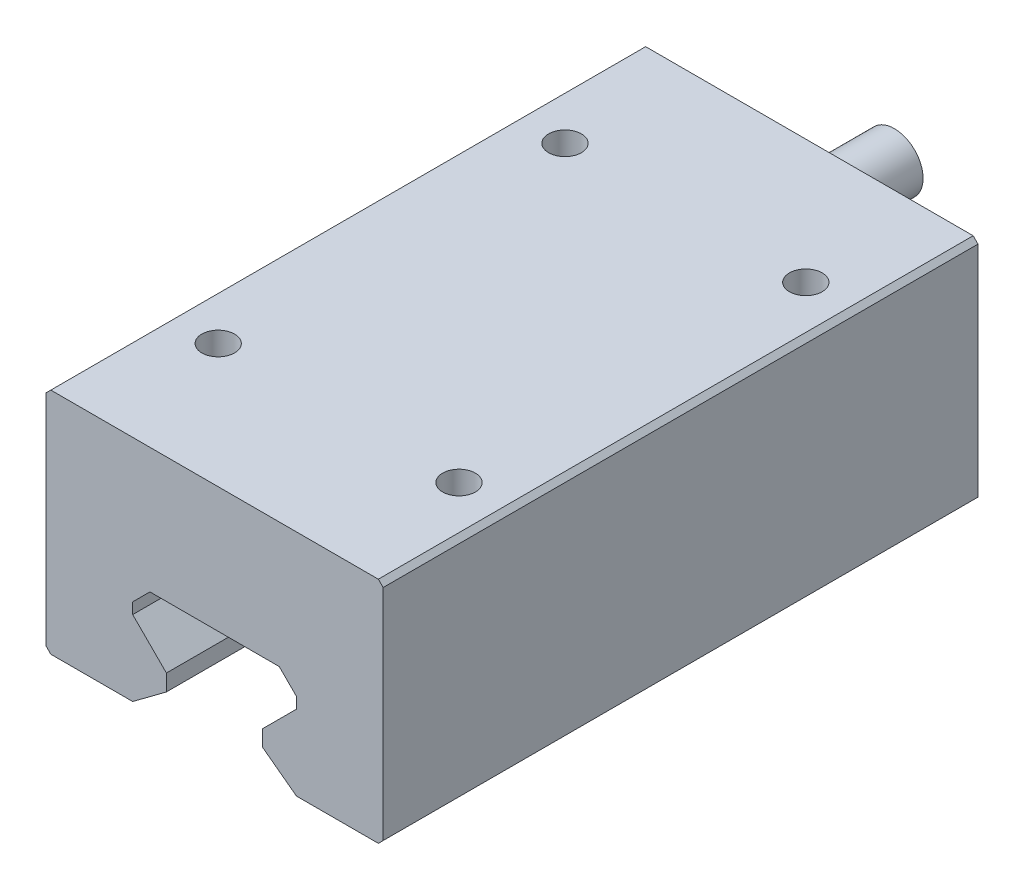
from build123d import *

# Parameters (mm, degrees)
EXTRUDE_1_DEPTH        = 123.5
CHAMFER_1_SIZE         = 1
HOLE_WIZARD_M8_1_D     = 6.8
HOLE_WIZARD_M8_1_DEPTH = 15
HOLE_WIZARD_M8_1_TIP   = 2.042926105
SKETCH_5_R             = 5.961453201
EXTRUDE_2_DEPTH        = 15.6


with BuildPart() as part:
    # 草圖2 → 伸長1 (new body)
    with BuildSketch(Plane.XY):
        Polygon((-17, 7.5), (-35, 7.5), (-35, 55), (35, 55), (35, 7.5), (17, 7.5), (10, 12.721375014), (10, 16.129907798), (17, 23.129907798), (17, 25.4259063), (13.4259063, 29), (-13.4259063, 29), (-17, 25.4259063), (-17, 23.129907798), (-10, 16.129907798), (-10, 12.721375014), align=None)
    extrude(amount=EXTRUDE_1_DEPTH)

    # 導角1
    chamfer_1_edges = [part.edges().sort_by_distance(p)[0] for p in [
        (-35, 7.5, 61.75),
        (-35, 55, 61.75),
        (35, 55, 61.75),
        (35, 7.5, 61.75),
    ]]
    chamfer(chamfer_1_edges, length=CHAMFER_1_SIZE)

    # M8 螺紋孔1
    with Locations(Plane(origin=(0, 55, 0), x_dir=(-1, 0, 0), z_dir=(0, 1, 0))):
        with Locations((25, 97.75), (25, 25.75), (-25, 25.75), (-25, 97.75)):
            Hole(HOLE_WIZARD_M8_1_D / 2, depth=HOLE_WIZARD_M8_1_DEPTH)
            with Locations((0, 0, -(HOLE_WIZARD_M8_1_DEPTH + HOLE_WIZARD_M8_1_TIP / 2))):  # 118° drill point
                Cone(0, HOLE_WIZARD_M8_1_D / 2, HOLE_WIZARD_M8_1_TIP, mode=Mode.SUBTRACT)

    # 草圖5 → 伸長2 (add)
    with BuildSketch(Plane(origin=(0, 0, 0), x_dir=(-1, 0, 0), z_dir=(0, 0, -1))):
        with Locations((-2.037583141, 44.518465944)):
            Circle(SKETCH_5_R)
    extrude(amount=EXTRUDE_2_DEPTH)


solid = part.part
